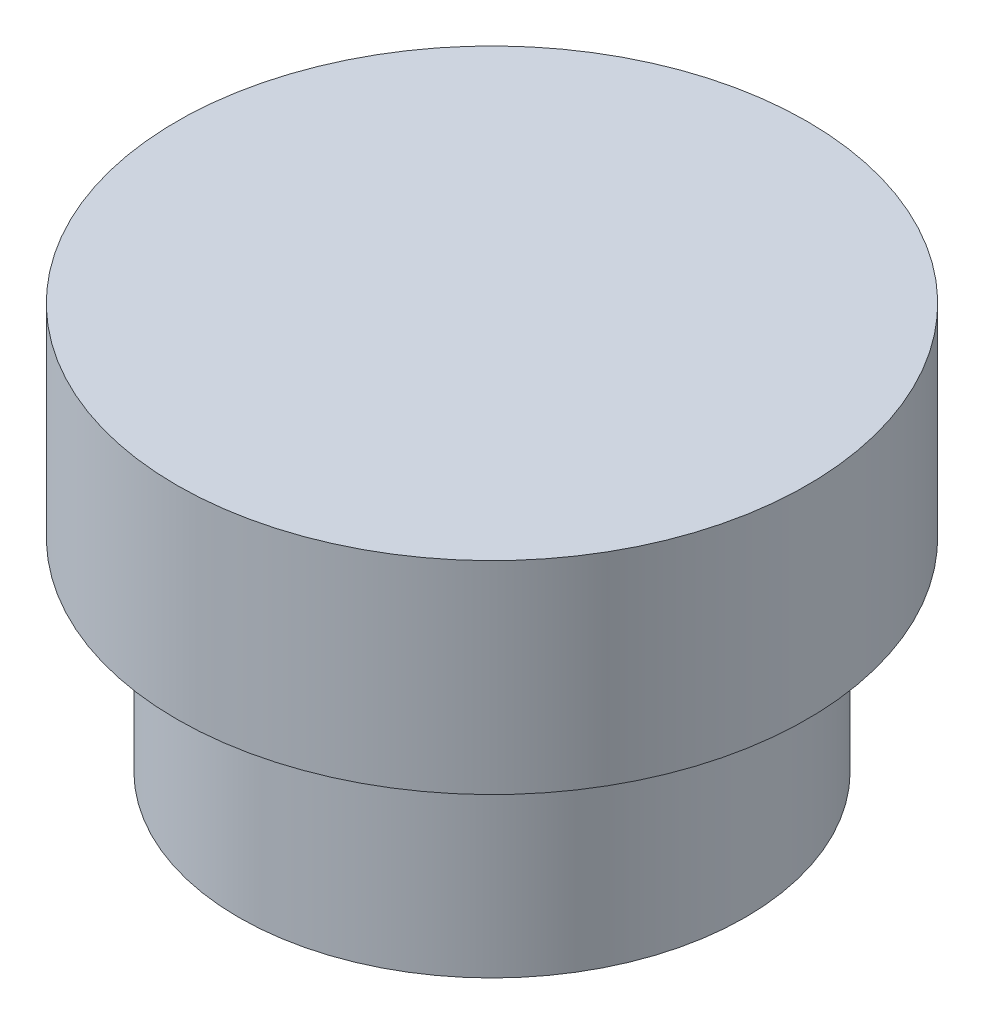
from build123d import *

# Parameters (mm, degrees)
ESQUISSE1_R          = 14
BASE_EXTRUSION_DEPTH = 9
ESQUISSE2_R          = 11.25
BOSS_EXTRU_1_DEPTH   = 9


with BuildPart() as part:
    # Esquisse1 → Base-Extrusion (new body)
    with BuildSketch(Plane(origin=(0, 0, 0), x_dir=(1, 0, 0), z_dir=(0, 1, 0))):
        with Locations(Location((0, 0, 0), (0, 0, 270))):
            Circle(ESQUISSE1_R)
    extrude(amount=BASE_EXTRUSION_DEPTH)

    # Esquisse2 → Boss.-Extru.1 (add)
    with BuildSketch(Plane.XZ):
        with Locations(Location((0, 0, 0), (0, 0, 90))):
            Circle(ESQUISSE2_R)
    extrude(amount=BOSS_EXTRU_1_DEPTH)


solid = part.part
